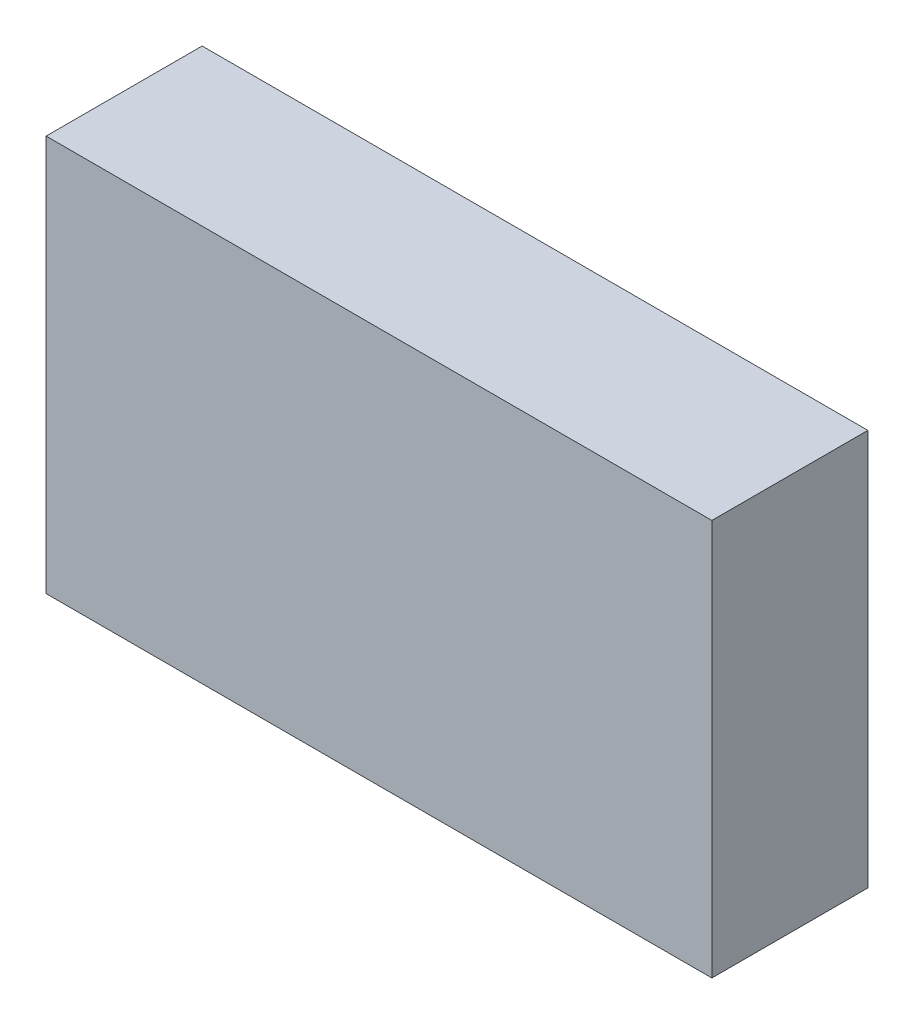
from build123d import *

# Parameters (mm, degrees)
SKETCH1_W               = 4.2672
SKETCH1_H               = 2.54
COMPONENT_OUTLINE_DEPTH = 1


with BuildPart() as part:
    # Sketch1 → Component_Outline (new body)
    with BuildSketch(Plane.XY):
        with Locations((0.3556, 0)):
            Rectangle(SKETCH1_W, SKETCH1_H)
    extrude(amount=COMPONENT_OUTLINE_DEPTH)


solid = part.part
